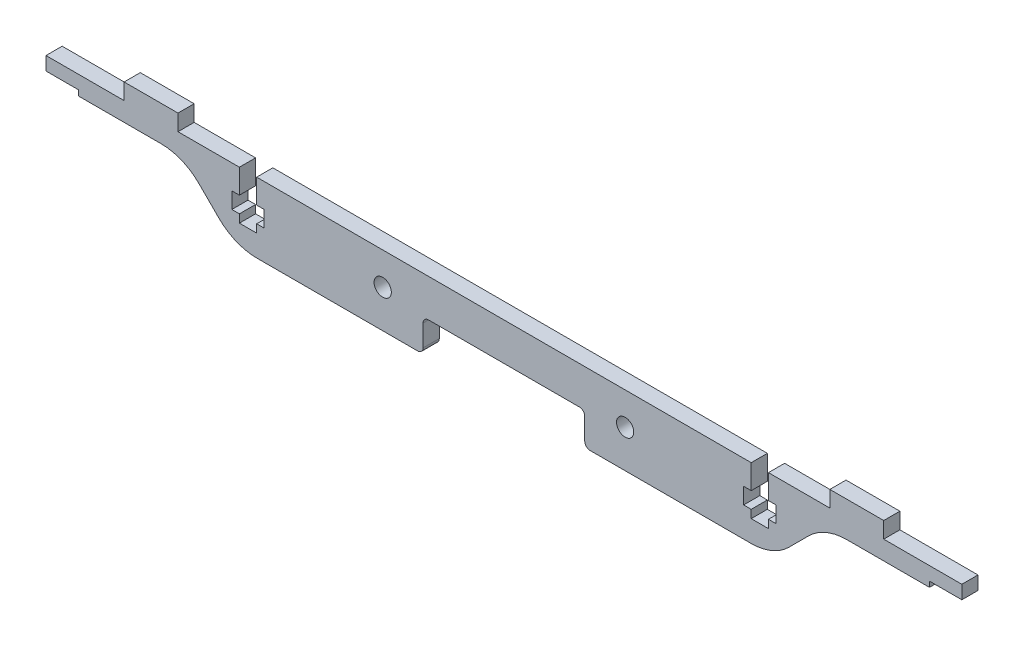
from build123d import *

# Parameters (mm, degrees)
EXTRUDE_1_DEPTH     = 3
SKETCH_2_W          = 55
SKETCH_2_H          = 3
CUT_EXTRUDE_1_DEPTH = 86.300937861
EXTRUDE_2_DEPTH     = 3
FILLET_1_R          = 10
SKETCH_4_R          = 1.6
SKETCH_4_W          = 30
SKETCH_4_H          = 6
CUT_EXTRUDE_2_DEPTH = 86.581832184
FILLET_2_R          = 1


with BuildPart() as part:
    # 草图1 → 凸台-拉伸1 (new body)
    with BuildSketch(Plane.XY):
        Polygon((-85, 1), (-85, 3.5), (-70.5, 3.5), (-70.5, 6.5), (-60.5, 6.5), (-60.5, 3.5), (-27.5, 3.5), (-27.5, 6.5), (-17.5, 6.5), (-17.5, 3.5), (17.5, 3.5), (17.5, 6.5), (27.5, 6.5), (27.5, 3.5), (60.5, 3.5), (60.5, 6.5), (70.5, 6.5), (70.5, 3.5), (85, 3.5), (85, 1), (79, 1), (79, 0), (-79, 0), (-79, 1), align=None)
    extrude(amount=EXTRUDE_1_DEPTH)

    # 草图2 → 切除-拉伸1 (cut, through all)
    with BuildSketch(Plane.XY.offset(3)):
        with Locations((0, 5)):
            Rectangle(SKETCH_2_W, SKETCH_2_H)
    extrude(amount=-CUT_EXTRUDE_1_DEPTH, mode=Mode.SUBTRACT)

    # 草图3 → 凸台-拉伸2 (add)
    with BuildSketch(Plane.XY.offset(3)):
        Polygon((-50, 0), (50, 0), (59.5, 0), (50, -9.5), (-50, -9.5), (-59.5, 0), align=None)
    extrude(amount=-EXTRUDE_2_DEPTH)

    # 圆角1
    fillet_1_edges = [part.edges().sort_by_distance(p)[0] for p in [
        (-59.5, 0, 1.5),
        (59.5, 0, 1.5),
        (50, -9.5, 1.5),
        (-50, -9.5, 1.5),
    ]]
    fillet(fillet_1_edges, radius=FILLET_1_R)

    # 草图4 → 切除-拉伸2 (cut, through all)
    with BuildSketch(Plane.XY.offset(3)):
        with Locations((-22.5, -2.5)):
            Circle(SKETCH_4_R)
        with Locations((22.5, -2.5)):
            Circle(SKETCH_4_R)
        Polygon((-49.1, 3.5), (-45.9, 3.5), (-45.9, -1), (-44.5, -1), (-44.5, -4), (-45.9, -4), (-45.9, -5.5), (-49.1, -5.5), (-49.1, -4), (-50.5, -4), (-50.5, -1), (-49.1, -1), align=None)
        Polygon((50.5, -1), (49.1, -1), (49.1, 3.5), (45.9, 3.5), (45.9, -1), (44.5, -1), (44.5, -4), (45.9, -4), (45.9, -5.5), (49.1, -5.5), (49.1, -4), (50.5, -4), align=None)
        with Locations((0, -6.5)):
            Rectangle(SKETCH_4_W, SKETCH_4_H)
    extrude(amount=-CUT_EXTRUDE_2_DEPTH, mode=Mode.SUBTRACT)

    # 圆角2
    fillet_2_edges = [part.edges().sort_by_distance(p)[0] for p in [
        (-15, -9.5, 1.5),
        (-15, -3.5, 1.5),
        (15, -3.5, 1.5),
        (15, -9.5, 1.5),
    ]]
    fillet(fillet_2_edges, radius=FILLET_2_R)


solid = part.part
